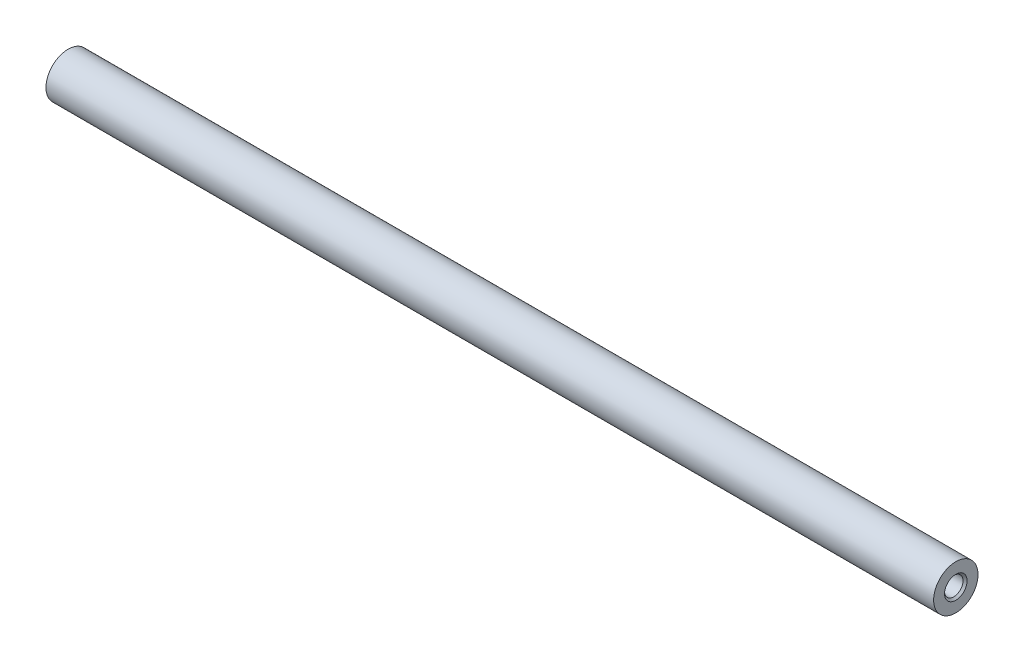
from build123d import *

# Parameters (mm, degrees)
SKETCH_1_R                   = 3
EXTRUDE_1_DEPTH              = 120
HOLE_WIZARD_M3_1_D           = 2.5
HOLE_WIZARD_M3_1_CSINK_D     = 3.05
HOLE_WIZARD_M3_1_CSINK_ANGLE = 90


with BuildPart() as part:
    # 草图1 → 凸台-拉伸1 (new body)
    with BuildSketch(Plane(origin=(0, 0, 0), x_dir=(0, 0, -1), z_dir=(1, 0, 0))):
        Circle(SKETCH_1_R)
    extrude(amount=EXTRUDE_1_DEPTH)

    # M3 螺纹孔1 (through all)
    with Locations(Plane(origin=(120, 0, 0), x_dir=(0, 0, -1), z_dir=(1, 0, 0))):
        with Locations((0, 0)):
            CounterSinkHole(HOLE_WIZARD_M3_1_D / 2, HOLE_WIZARD_M3_1_CSINK_D / 2, counter_sink_angle=HOLE_WIZARD_M3_1_CSINK_ANGLE)


solid = part.part
